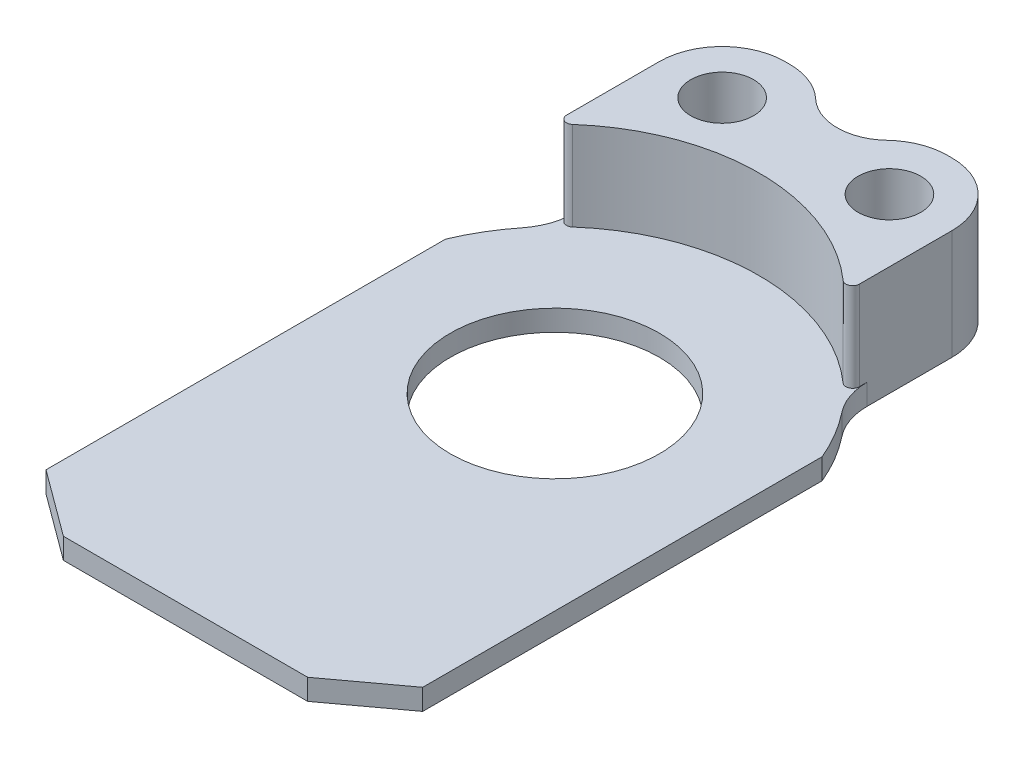
from build123d import *

# Parameters (mm, degrees)
SKETCH1_R           = 7.9375
BOSS_EXTRUDE1_DEPTH = 1.5875
SKETCH2_R           = 2.38125
BOSS_EXTRUDE2_DEPTH = 8.334375
CUT_EXTRUDE1_START  = -6.746875
CUT_EXTRUDE1_DEPTH  = 6.746875


with BuildPart() as part:
    # Sketch1 → Boss-Extrude1 (new body)
    with BuildSketch(Plane(origin=(0, 0, 0), x_dir=(1, 0, 0), z_dir=(0, 1, 0))):
        with BuildLine():
            Line((-14.3002, -24.3332), (-9.271, -28.0416))
            Line((-9.271, -28.0416), (9.271, -28.0416))
            Line((9.271, -28.0416), (14.3002, -24.3332))
            Line((14.3002, -24.3332), (14.3002, 5.9944))
            ThreePointArc((14.3002, 5.9944), (0, 15.505758653), (-14.3002, 5.9944))
            Line((-14.3002, 5.9944), (-14.3002, -24.3332))
        make_face()
        with Locations(Location((0, 0, 0), (0, 0, 270))):
            Circle(SKETCH1_R, mode=Mode.SUBTRACT)
    extrude(amount=BOSS_EXTRUDE1_DEPTH)

    # Sketch2 → Boss-Extrude2 (add)
    with BuildSketch(Plane.XZ):
        with BuildLine():
            Line((-11.1125, -12.601058837), (-11.1125, -19.05))
            ThreePointArc((-11.1125, -19.05), (-9.717596045, -22.417596045), (-6.35, -23.8125))
            Line((-6.35, -23.8125), (-5.983425441, -23.8125))
            ThreePointArc((-5.983425441, -23.8125), (-4.22646321, -23.476566386), (-2.717363519, -22.516157205))
            ThreePointArc((-2.717363519, -22.516157205), (0, -21.4376), (2.717363519, -22.516157205))
            ThreePointArc((2.717363519, -22.516157205), (4.22646321, -23.476566386), (5.983425441, -23.8125))
            Line((5.983425441, -23.8125), (6.35, -23.8125))
            ThreePointArc((6.35, -23.8125), (9.717596045, -22.417596045), (11.1125, -19.05))
            Line((11.1125, -19.05), (11.1125, -12.601058837))
            ThreePointArc((11.1125, -12.601058837), (11.377973728, -11.033206497), (12.144798566, -9.640146223))
            ThreePointArc((12.144798566, -9.640146223), (0, -15.505758653), (-12.144798566, -9.640146223))
            ThreePointArc((-12.144798566, -9.640146223), (-11.377973728, -11.033206497), (-11.1125, -12.601058837))
        make_face()
        with Locations(Location((-6.35, -19.05, 0), (0, 0, 270))):
            Circle(SKETCH2_R, mode=Mode.SUBTRACT)
        with Locations(Location((6.35, -19.05, 0), (0, 0, 270))):
            Circle(SKETCH2_R, mode=Mode.SUBTRACT)
    extrude(amount=-BOSS_EXTRUDE2_DEPTH)

    # Sketch3 → Cut-Extrude1 (cut)
    with BuildSketch(Plane(origin=(0, 8.334375, 0), x_dir=(1, 0, 0), z_dir=(0, 1, 0)).offset(CUT_EXTRUDE1_START)):
        with BuildLine():
            Line((-11.1125, 19.05), (-11.1125, 11.999376898))
            ThreePointArc((-11.1125, 11.999376898), (-10.813271374, 11.536258648), (-10.268096404, 11.618724011))
            ThreePointArc((-10.268096404, 11.618724011), (0, 15.505758653), (10.268096404, 11.618724011))
            ThreePointArc((10.268096404, 11.618724011), (10.813271374, 11.536258648), (11.1125, 11.999376898))
            Line((11.1125, 11.999376898), (11.1125, 19.05))
            Line((11.1125, 19.05), (16.416178114, 6.350325815))
            Line((16.416178114, 6.350325815), (-16.620971452, 6.890442702))
            Line((-16.620971452, 6.890442702), (-11.1125, 19.05))
        make_face()
    extrude(amount=CUT_EXTRUDE1_DEPTH, mode=Mode.SUBTRACT)


solid = part.part
